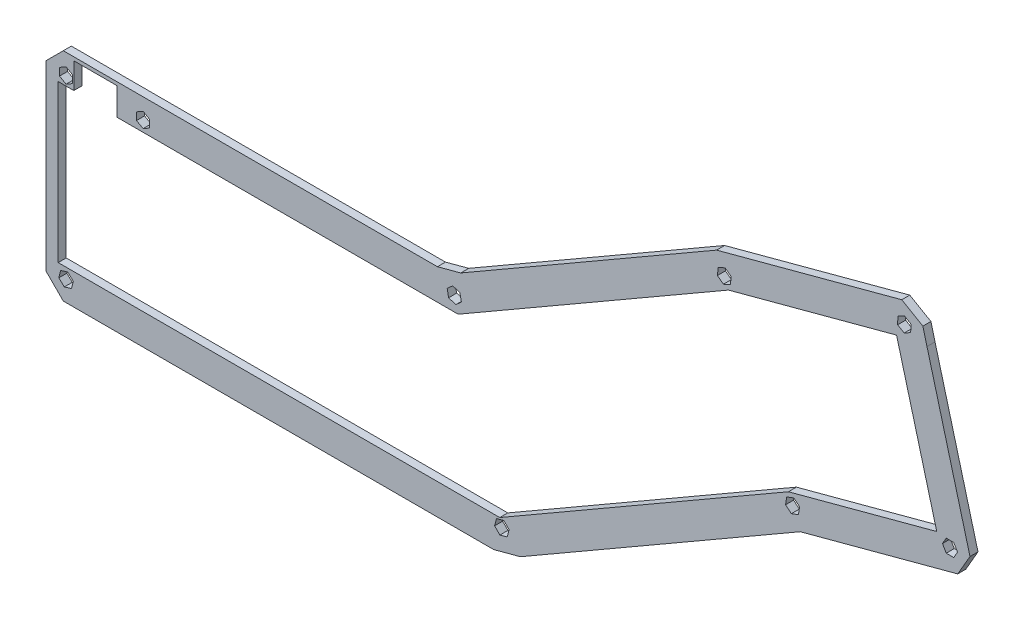
from build123d import *

# Parameters (mm, degrees)
BOSS_EXTRU_1_DEPTH = 3


with BuildPart() as part:
    # Esquisse1 → Boss.-Extru.1 (new body)
    with BuildSketch(Plane.XY):
        Polygon((-75.988646329, 51.585106383), (-76.753762562, 51.585106383), (-92.861789188, 51.585106383), (-94.860830925, 51.585106383), (-96.789296468, 51.585106383), (-103.253762562, 45.120640289), (-103.253762562, 35.79522772), (-103.253762562, -22.950427523), (-96.789296468, -29.414893617), (63.997857106, -29.414893617), (73.963816863, -26.744522748), (178.515758799, 33.618569072), (237.335031683, 49.379145741), (241.906099495, 57.296467436), (230.508864659, 99.83152691), (225.851857518, 117.211714172), (224.321712805, 123.047343228), (216.426306891, 127.634040432), (210.540810955, 126.057026548), (147.250925797, 109.098552931), (51.669750275, 53.914735514), (42.975455994, 51.585106383), align=None)
        Polygon((-95.09515421, -19.181421764), (-93.057202321, -21.118529255), (-93.715810673, -23.852001108), (-96.412370914, -24.64836547), (-98.450322803, -22.71125798), (-97.791714451, -19.977786126), align=None, mode=Mode.SUBTRACT)
        Polygon((67.767414571, -18.119374886), (69.755583746, -20.107544061), (69.027863321, -22.82343366), (66.311973721, -23.551154085), (64.323804547, -21.56298491), (65.051524972, -18.847095311), align=None, mode=Mode.SUBTRACT)
        Polygon((-93.318762562, 45.490954288), (-93.318762562, 42.679258478), (-95.753762562, 41.273410572), (-98.188762562, 42.679258478), (-98.188762562, 45.490954288), (-95.753762562, 46.896802194), align=None, mode=Mode.SUBTRACT)
        Polygon((-66.988646329, 46.896802194), (-64.553646329, 45.490954288), (-64.553646329, 42.679258478), (-66.988646329, 41.273410572), (-69.423646329, 42.679258478), (-69.423646329, 45.490954288), align=None, mode=Mode.SUBTRACT)
        Polygon((51.366225237, 47.372350111), (51.931744927, 44.618113227), (49.829265662, 42.751240367), (47.161266708, 43.638604392), (46.595747018, 46.392841276), (48.698226283, 48.259714136), align=None, mode=Mode.SUBTRACT)
        Polygon((-76.753762562, 40.085106383), (2.011353671, 40.085106383), (50.71612997, 40.085106383), (151.689760112, 98.382258927), (214.4831558, 115.207698591), (229.494660416, 59.184000666), (174.076924484, 44.334863077), (66.257183131, -17.914893617), (-98.698564415, -17.914893617), (-98.698564415, 40.655573641), (-94.860830925, 40.655573641), (-92.861789188, 40.655573641), (-92.861789188, 48.636078378), (-92.861789188, 50.298812036), (-76.753762562, 50.298812036), (-76.753762562, 49.585106383), (-76.753762562, 48.636078378), align=None, mode=Mode.SUBTRACT)
        Polygon((176.099626255, 43.341034088), (178.27036991, 41.553995947), (177.808121311, 38.780557726), (175.175129056, 37.794157645), (173.004385401, 39.581195786), (173.466634, 42.354634007), align=None, mode=Mode.SUBTRACT)
        Polygon((235.851309069, 58.804459007), (237.257156975, 56.369459007), (235.851309069, 53.934459007), (233.039613258, 53.934459007), (231.633765353, 56.369459007), (233.039613258, 58.804459007), align=None, mode=Mode.SUBTRACT)
        Polygon((150.436891261, 104.94434728), (152.703485209, 103.280560873), (152.395900888, 100.48573973), (149.821722619, 99.354704995), (147.555128671, 101.018491402), (147.862712992, 103.813312544), align=None, mode=Mode.SUBTRACT)
        Polygon((219.824270363, 121.480626406), (219.771686266, 118.66942235), (217.310820089, 117.309359486), (214.90253801, 118.760500678), (214.955122108, 121.571704735), (217.415988284, 122.931767598), align=None, mode=Mode.SUBTRACT)
    extrude(amount=BOSS_EXTRU_1_DEPTH)


solid = part.part
